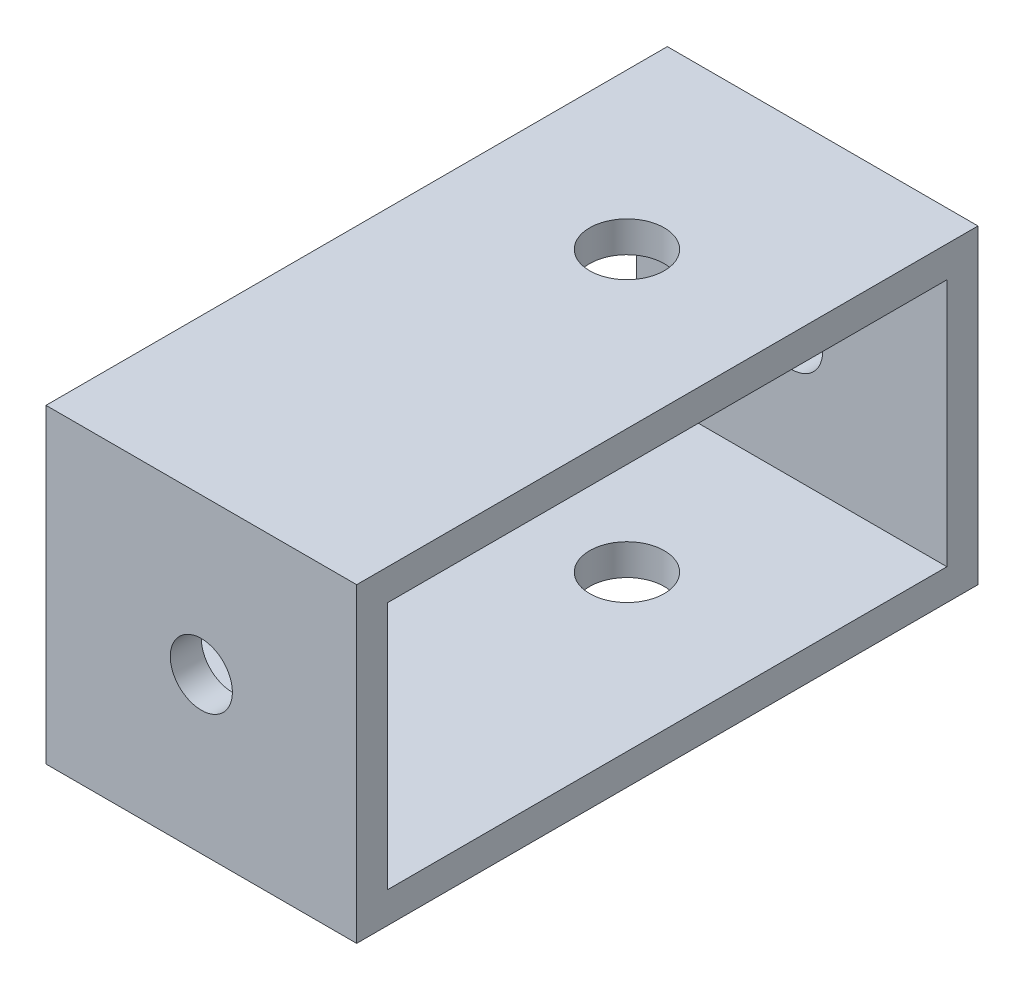
from build123d import *

# Parameters (mm, degrees)
SKETCH1_W           = 50.8
SKETCH1_H           = 25.4
SKETCH1_W_2         = 45.72
SKETCH1_H_2         = 20.32
BOSS_EXTRUDE1_DEPTH = 25.4
SKETCH3_R           = 3.048
CUT_EXTRUDE1_DEPTH  = 63.217039467
SKETCH4_R           = 2.54
CUT_EXTRUDE2_DEPTH  = 63.217039467


with BuildPart() as part:
    # Sketch1 → Boss-Extrude1 (new body)
    with BuildSketch(Plane(origin=(0, 0, 0), x_dir=(0, 0, -1), z_dir=(1, 0, 0))):
        with Locations((25.4, 12.7)):
            Rectangle(SKETCH1_W, SKETCH1_H)
        with Locations((25.4, 12.7)):
            Rectangle(SKETCH1_W_2, SKETCH1_H_2, mode=Mode.SUBTRACT)
    extrude(amount=BOSS_EXTRUDE1_DEPTH)

    # Sketch3 → Cut-Extrude1 (cut, through all)
    with BuildSketch(Plane(origin=(0, 25.4, 0), x_dir=(1, 0, 0), z_dir=(0, 1, 0))):
        with Locations(Location((12.7, 34.798, 0), (0, 0, 270))):
            Circle(SKETCH3_R)
    extrude(amount=-CUT_EXTRUDE1_DEPTH, mode=Mode.SUBTRACT)

    # Sketch4 → Cut-Extrude2 (cut, through all)
    with BuildSketch(Plane.XY):
        with Locations((12.7, 12.7)):
            Circle(SKETCH4_R)
    extrude(amount=-CUT_EXTRUDE2_DEPTH, mode=Mode.SUBTRACT)


solid = part.part
